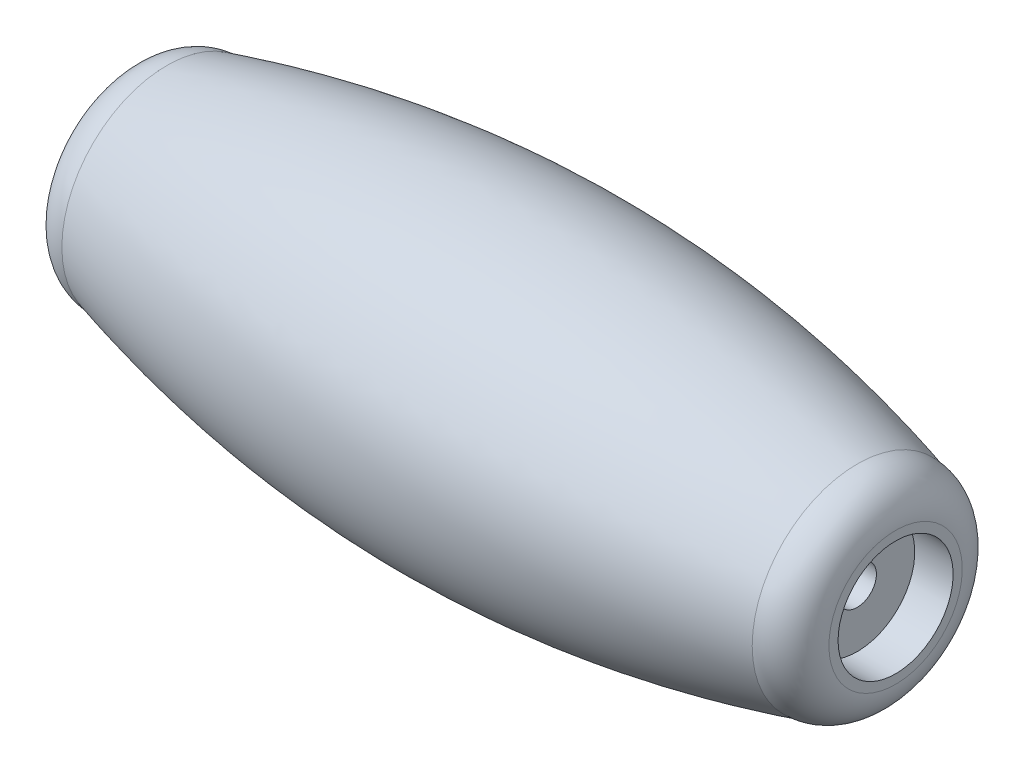
from build123d import *


with BuildPart() as part:
    # Sketch2 → Revolve1 (revolve)
    with BuildSketch(Plane.XY, mode=Mode.PRIVATE) as revolve1_sk:
        with BuildLine():
            Line((13.5, 0.75), (-13.5, 0.75))
            Line((-13.5, 0.75), (-13.5, 2.25))
            Line((-13.5, 2.25), (-15, 2.25))
            Line((-15, 2.25), (-15, 2.608319309))
            ThreePointArc((-15, 2.608319309), (-14.560660172, 3.668979481), (-13.5, 4.108319309))
            add(Edge.make_bspline(
                [(-13.5, 4.108319309), (0, 7.891680691), (13.5, 4.108319309)],
                knots=[0, 0, 0, 1, 1, 1], degree=2))
            ThreePointArc((13.5, 4.108319309), (14.560660172, 3.668979481), (15, 2.608319309))
            Line((15, 2.608319309), (15, 2.25))
            Line((15, 2.25), (13.5, 2.25))
            Line((13.5, 2.25), (13.5, 0.75))
        make_face()
    revolve(revolve1_sk.sketch.rotate(Axis((-15, 0, 0), (1, 0, 0)), 90), axis=Axis((-15, 0, 0), (1, 0, 0)))


solid = part.part
